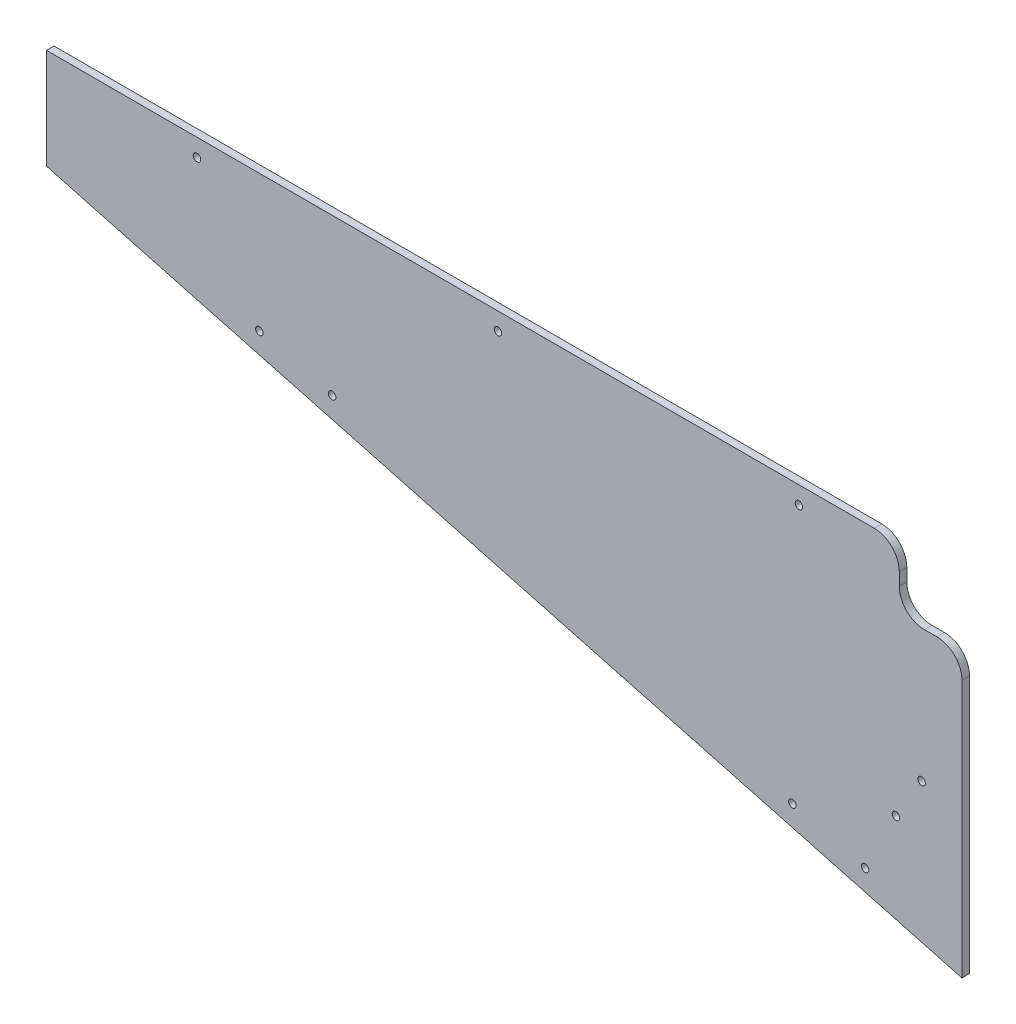
from build123d import *

# Parameters (mm, degrees)
EXTRUDE_1_DEPTH     = 3
SKETCH_3_W          = 25
SKETCH_3_H          = 25
CUT_EXTRUDE_1_DEPTH = 391.157969373
SKETCH_5_R          = 1.5
CUT_EXTRUDE_3_DEPTH = 391.157969373
FILLET_2_R          = 10
SKETCH_6_R          = 1.5
CUT_EXTRUDE_6_DEPTH = 10
SKETCH_7_R          = 1.5
CUT_EXTRUDE_7_DEPTH = 391.157969373


with BuildPart() as part:
    # 草图1 → 凸台-拉伸1 (new body)
    with BuildSketch(Plane.XY):
        Polygon((0, -137.801455237), (0, 0), (-365, 0), (-365, -40), align=None)
    extrude(amount=EXTRUDE_1_DEPTH)

    # 草图3 → 切除-拉伸1 (cut, through all)
    with BuildSketch(Plane.XY.offset(3)):
        with Locations((-12.5, -12.5)):
            Rectangle(SKETCH_3_W, SKETCH_3_H)
    extrude(amount=-CUT_EXTRUDE_1_DEPTH, mode=Mode.SUBTRACT)

    # 草图5 → 切除-拉伸3 (cut, through all)
    with BuildSketch(Plane.XY.offset(3)):
        with Locations((-305, -7)):
            Circle(SKETCH_5_R)
        with Locations((-185, -7)):
            Circle(SKETCH_5_R)
        with Locations((-65, -7)):
            Circle(SKETCH_5_R)
    extrude(amount=-CUT_EXTRUDE_3_DEPTH, mode=Mode.SUBTRACT)

    # 圆角2
    fillet_2_edges = [part.edges().sort_by_distance(p)[0] for p in [
        (0, -25, 1.5),
        (-25, -25, 1.5),
        (-25, 0, 1.5),
    ]]
    fillet(fillet_2_edges, radius=FILLET_2_R)

    # 草图6 → 切除-拉伸6 (cut)
    with BuildSketch(Plane.XY.offset(3)):
        with Locations((-38.637033052, -119.16648399)):
            Circle(SKETCH_6_R)
        with Locations((-67.61480784, -111.401912637)):
            Circle(SKETCH_6_R)
        with Locations((-251.140714835, -62.226294067)):
            Circle(SKETCH_6_R)
        with Locations((-280.118489624, -54.461722714)):
            Circle(SKETCH_6_R)
    extrude(amount=-CUT_EXTRUDE_6_DEPTH, mode=Mode.SUBTRACT)

    # 草图7 → 切除-拉伸7 (cut, through all)
    with BuildSketch(Plane.XY.offset(3)):
        with Locations((-26.327035604, -95.030119084)):
            Circle(SKETCH_7_R)
        with Locations((-16.086178306, -77.850921146)):
            Circle(SKETCH_7_R)
    extrude(amount=-CUT_EXTRUDE_7_DEPTH, mode=Mode.SUBTRACT)


solid = part.part
